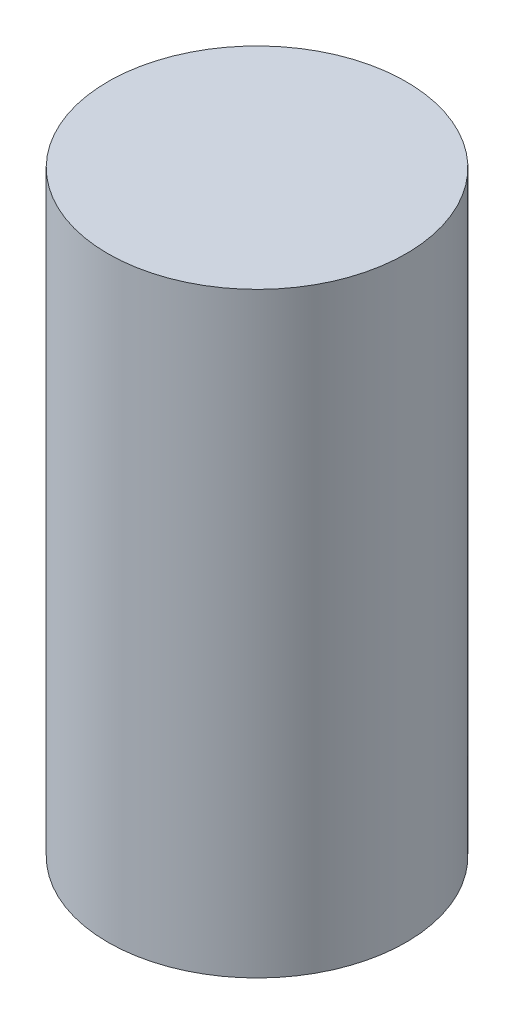
from build123d import *

# Parameters (mm, degrees)
SKETCH1_R           = 1.5
BOSS_EXTRUDE1_DEPTH = 6


with BuildPart() as part:
    # Sketch1 → Boss-Extrude1 (new body)
    with BuildSketch(Plane(origin=(0, 0, 0), x_dir=(1, 0, 0), z_dir=(0, 1, 0))):
        with Locations(Location((0, 0, 0), (0, 0, 270))):
            Circle(SKETCH1_R)
    extrude(amount=BOSS_EXTRUDE1_DEPTH)


solid = part.part
